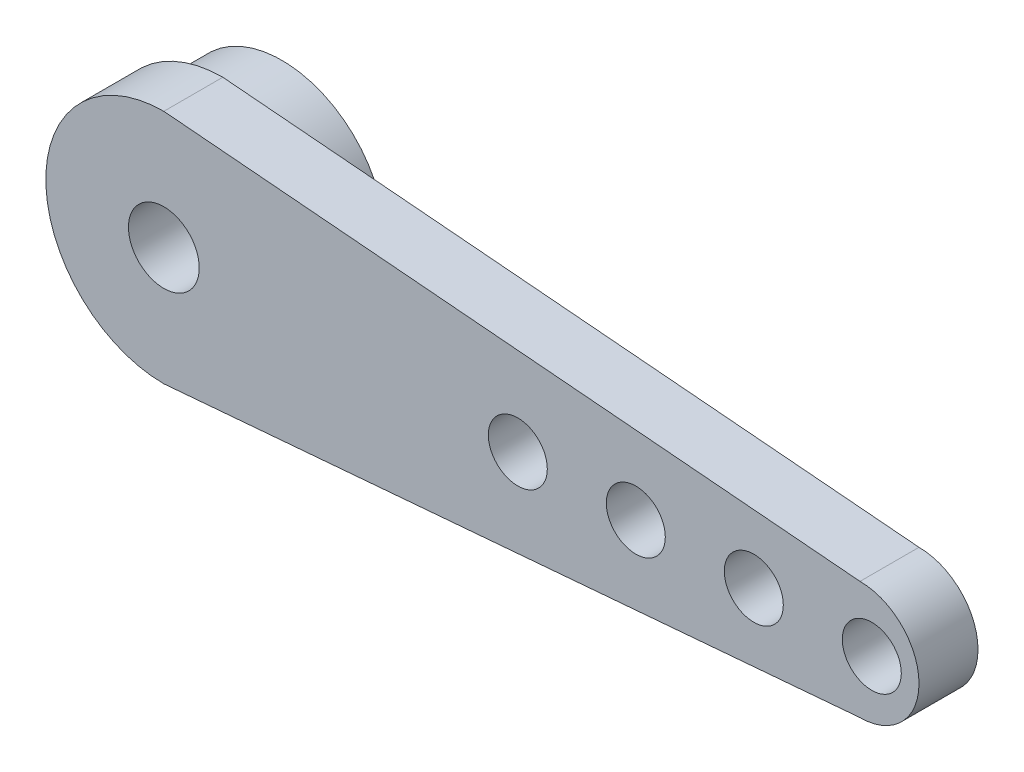
from build123d import *

# Parameters (mm, degrees)
SKETCH1_R           = 1.5
SKETCH1_R_2         = 1.25
BOSS_EXTRUDE1_DEPTH = 2.5
SKETCH2_R           = 4.375
SKETCH2_R_2         = 2.85
BOSS_EXTRUDE2_DEPTH = 2.5


with BuildPart() as part:
    # Sketch1 → Boss-Extrude1 (new body)
    with BuildSketch(Plane.XY):
        with BuildLine():
            Line((0.841414718, 4.928693668), (0, 5))
            ThreePointArc((0, 5), (-5, 0), (0, -5))
            Line((0, -5), (0.841414718, -4.928693668))
            Line((0.841414718, -4.928693668), (29.5, -2.5))
            ThreePointArc((29.5, -2.5), (32, 0), (29.5, 2.5))
            Line((29.5, 2.5), (0.841414718, 4.928693668))
        make_face()
        Circle(SKETCH1_R, mode=Mode.SUBTRACT)
        with Locations((15, 0)):
            Circle(SKETCH1_R_2, mode=Mode.SUBTRACT)
        with Locations((20, 0)):
            Circle(SKETCH1_R_2, mode=Mode.SUBTRACT)
        with Locations((25, 0)):
            Circle(SKETCH1_R_2, mode=Mode.SUBTRACT)
        with Locations((30, 0)):
            Circle(SKETCH1_R_2, mode=Mode.SUBTRACT)
    extrude(amount=BOSS_EXTRUDE1_DEPTH)

    # Sketch2 → Boss-Extrude2 (add)
    with BuildSketch(Plane(origin=(0, 0, 0), x_dir=(-1, 0, 0), z_dir=(0, 0, -1))):
        with Locations(Location((0, 0, 0), (0, 0, 180))):
            Circle(SKETCH2_R)
        Circle(SKETCH2_R_2, mode=Mode.SUBTRACT)
    extrude(amount=BOSS_EXTRUDE2_DEPTH)


solid = part.part
